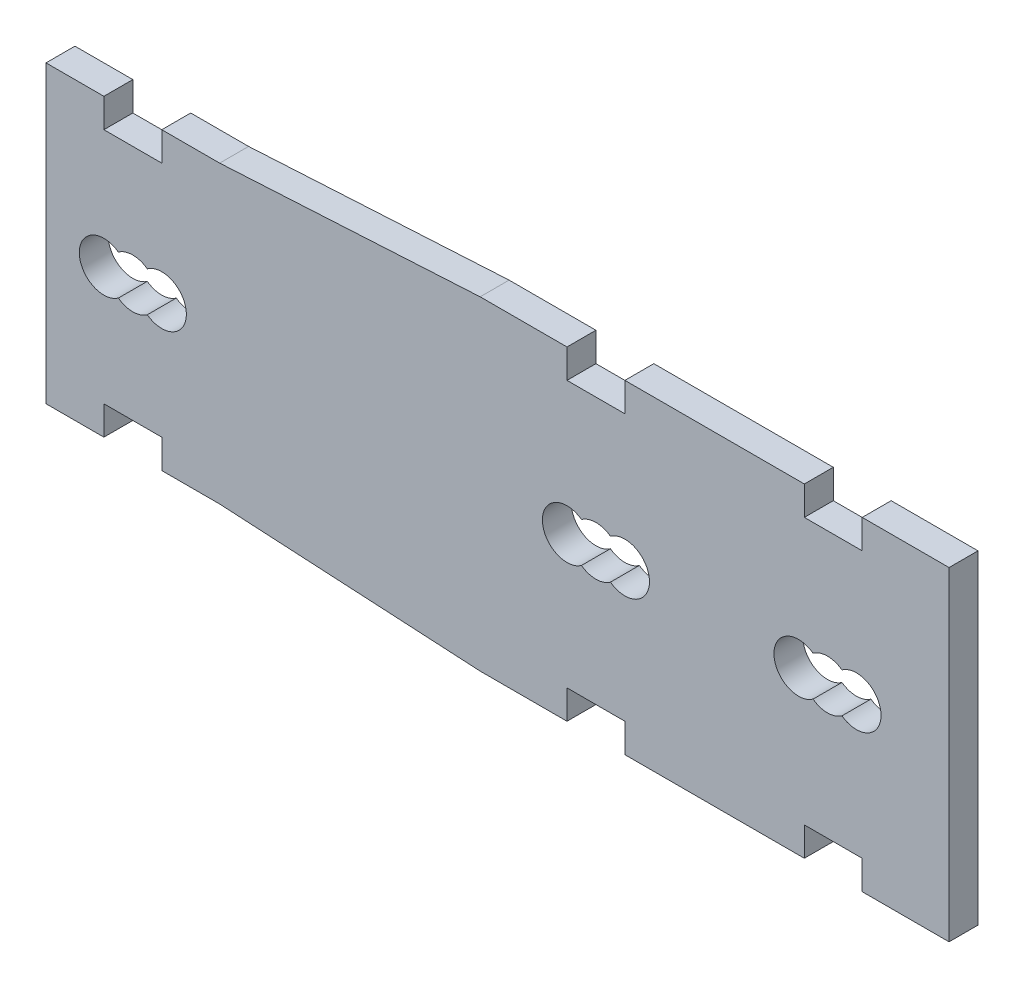
from build123d import *

# Parameters (mm, degrees)
BOSS_EXTRUDE1_DEPTH = 2.5
CUT_EXTRUDE1_REACH  = 111.75
SKETCH2_R           = 4.25


with BuildPart() as part:
    # Sketch1 → Boss-Extrude1 (new, symmetric)
    with BuildSketch(Plane(origin=(0, 0, 0), x_dir=(0, 1, 0), z_dir=(0, 0, 1))):
        Polygon((25.5, 50), (-25.5, 50), (-25.5, 40), (-20.5, 40), (-20.5, 30), (-25.5, 30), (-25.5, 20), (-28, -25), (-28, -40), (-23, -40), (-23, -50), (-28, -50), (-28, -81), (-23, -81), (-23, -91), (-28, -91), (-28, -106), (28, -106), (28, -91), (23, -91), (23, -81), (28, -81), (28, -50), (23, -50), (23, -40), (28, -40), (28, -25), (25.5, 20), (25.5, 30), (20.5, 30), (20.5, 40), (25.5, 40), align=None)
    extrude(amount=BOSS_EXTRUDE1_DEPTH, both=True)

    # Sketch2 → Cut-Extrude1 (cut, up to next)
    with BuildSketch(Plane.XY.offset(2.5), mode=Mode.PRIVATE) as cut_extrude1_sk1:
        with Locations((-35, 0)):
            Circle(SKETCH2_R)
    cut_extrude1_tool1 = extrude(cut_extrude1_sk1.sketch, amount=-CUT_EXTRUDE1_REACH, mode=Mode.PRIVATE) & part.part
    # Sketch2 → Cut-Extrude1 (cut, up to next)
    with BuildSketch(Plane.XY.offset(2.5), mode=Mode.PRIVATE) as cut_extrude1_sk2:
        with Locations((45, 0)):
            Circle(SKETCH2_R)
    cut_extrude1_tool2 = extrude(cut_extrude1_sk2.sketch, amount=-CUT_EXTRUDE1_REACH, mode=Mode.PRIVATE) & part.part
    # Sketch2 → Cut-Extrude1 (cut, up to next)
    with BuildSketch(Plane.XY.offset(2.5), mode=Mode.PRIVATE) as cut_extrude1_sk3:
        with Locations((85, 0)):
            Circle(SKETCH2_R)
    cut_extrude1_tool3 = extrude(cut_extrude1_sk3.sketch, amount=-CUT_EXTRUDE1_REACH, mode=Mode.PRIVATE) & part.part
    # Sketch2 → Cut-Extrude1 (cut, up to next)
    with BuildSketch(Plane.XY.offset(2.5), mode=Mode.PRIVATE) as cut_extrude1_sk4:
        with Locations((90, 0)):
            Circle(SKETCH2_R)
    cut_extrude1_tool4 = extrude(cut_extrude1_sk4.sketch, amount=-CUT_EXTRUDE1_REACH, mode=Mode.PRIVATE) & part.part
    # Sketch2 → Cut-Extrude1 (cut, up to next)
    with BuildSketch(Plane.XY.offset(2.5), mode=Mode.PRIVATE) as cut_extrude1_sk5:
        with Locations((50, 0)):
            Circle(SKETCH2_R)
    cut_extrude1_tool5 = extrude(cut_extrude1_sk5.sketch, amount=-CUT_EXTRUDE1_REACH, mode=Mode.PRIVATE) & part.part
    # Sketch2 → Cut-Extrude1 (cut, up to next)
    with BuildSketch(Plane.XY.offset(2.5), mode=Mode.PRIVATE) as cut_extrude1_sk6:
        with Locations((-30, 0)):
            Circle(SKETCH2_R)
    cut_extrude1_tool6 = extrude(cut_extrude1_sk6.sketch, amount=-CUT_EXTRUDE1_REACH, mode=Mode.PRIVATE) & part.part
    # Sketch2 → Cut-Extrude1 (cut, up to next)
    with BuildSketch(Plane.XY.offset(2.5), mode=Mode.PRIVATE) as cut_extrude1_sk7:
        with Locations((80, 0)):
            Circle(SKETCH2_R)
    cut_extrude1_tool7 = extrude(cut_extrude1_sk7.sketch, amount=-CUT_EXTRUDE1_REACH, mode=Mode.PRIVATE) & part.part
    # Sketch2 → Cut-Extrude1 (cut, up to next)
    with BuildSketch(Plane.XY.offset(2.5), mode=Mode.PRIVATE) as cut_extrude1_sk8:
        with Locations((40, 0)):
            Circle(SKETCH2_R)
    cut_extrude1_tool8 = extrude(cut_extrude1_sk8.sketch, amount=-CUT_EXTRUDE1_REACH, mode=Mode.PRIVATE) & part.part
    # Sketch2 → Cut-Extrude1 (cut, up to next)
    with BuildSketch(Plane.XY.offset(2.5), mode=Mode.PRIVATE) as cut_extrude1_sk9:
        with Locations((-40, 0)):
            Circle(SKETCH2_R)
    cut_extrude1_tool9 = extrude(cut_extrude1_sk9.sketch, amount=-CUT_EXTRUDE1_REACH, mode=Mode.PRIVATE) & part.part
    add(cut_extrude1_tool1.solids().sort_by_distance((-35, 0, 2.5))[0], mode=Mode.SUBTRACT)
    add(cut_extrude1_tool2.solids().sort_by_distance((45, 0, 2.5))[0], mode=Mode.SUBTRACT)
    add(cut_extrude1_tool3.solids().sort_by_distance((85, 0, 2.5))[0], mode=Mode.SUBTRACT)
    add(cut_extrude1_tool4.solids().sort_by_distance((90, 0, 2.5))[0], mode=Mode.SUBTRACT)
    add(cut_extrude1_tool5.solids().sort_by_distance((50, 0, 2.5))[0], mode=Mode.SUBTRACT)
    add(cut_extrude1_tool6.solids().sort_by_distance((-30, 0, 2.5))[0], mode=Mode.SUBTRACT)
    add(cut_extrude1_tool7.solids().sort_by_distance((80, 0, 2.5))[0], mode=Mode.SUBTRACT)
    add(cut_extrude1_tool8.solids().sort_by_distance((40, 0, 2.5))[0], mode=Mode.SUBTRACT)
    add(cut_extrude1_tool9.solids().sort_by_distance((-40, 0, 2.5))[0], mode=Mode.SUBTRACT)


solid = part.part
